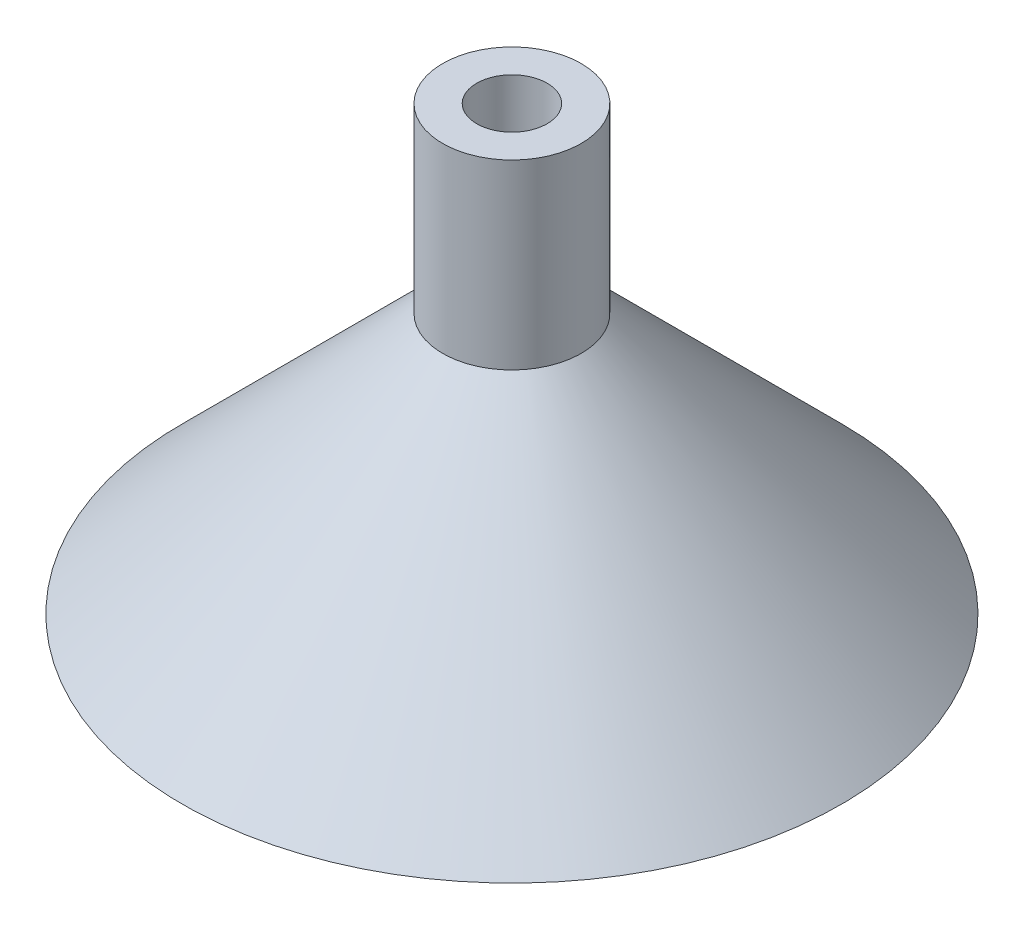
from build123d import *


with BuildPart() as part:
    # Sketch2 → Revolve1 (revolve)
    with BuildSketch(Plane.XY, mode=Mode.PRIVATE) as revolve1_sk:
        Polygon((25.323044738, 0), (29, 0), (6.096, 22.904), (6.096, 38.904), (3.096, 38.904), (3.096, 22.227044738), align=None)
    revolve(revolve1_sk.sketch.rotate(Axis((0, 0, 0), (0, 1, 0)), 90), axis=Axis((0, 0, 0), (0, 1, 0)))


solid = part.part
